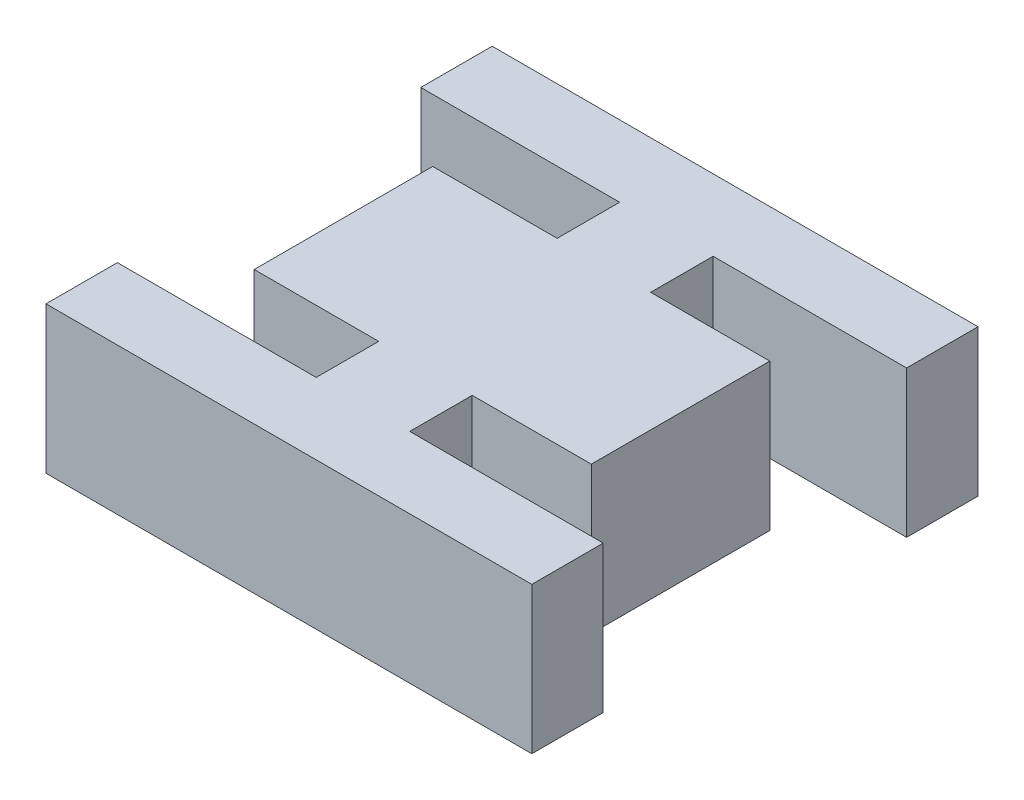
from build123d import *

# Parameters (mm, degrees)
BOSS_EXTRU_1_DEPTH = 74


with BuildPart() as part:
    # Esquisse1 → Boss.-Extru.1 (new body)
    with BuildSketch(Plane(origin=(0, 0, 0), x_dir=(1, 0, 0), z_dir=(0, 1, 0))):
        Polygon((-122.5, 76.5), (-22.226343262, 76.5), (-22.226343262, 45), (-85, 45), (-85, -45), (-22.226343262, -45), (-22.226343262, -76.5), (-122.5, -76.5), (-122.5, -112.5), (122.5, -112.5), (122.5, -76.5), (24.926363, -76.5), (24.926363, -45), (85, -45), (85, 45), (24.926363, 45), (24.926363, 76.5), (122.5, 76.5), (122.5, 112.5), (-122.5, 112.5), align=None)
    extrude(amount=BOSS_EXTRU_1_DEPTH)


solid = part.part
